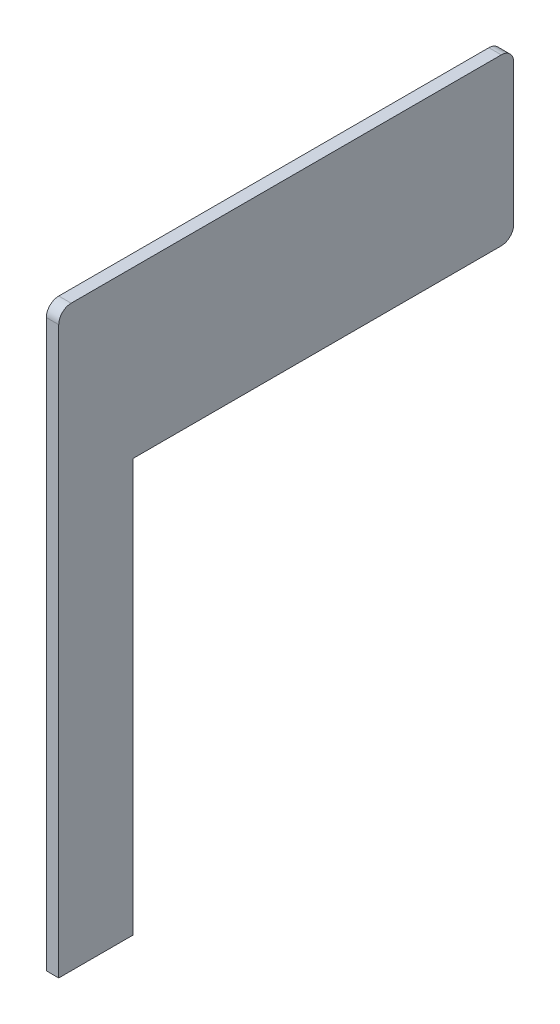
from build123d import *

# Parameters (mm, degrees)
EXTRUDE_1_DEPTH = 0.3
FILLET_1_R      = 0.3
SKETCH_4_W      = 0.3
SKETCH_4_H      = 1.8
EXTRUDE_3_DEPTH = 3


with BuildPart() as part:
    # 草图1 → 凸台-拉伸1 (new body)
    with BuildSketch(Plane(origin=(0, 0, 0), x_dir=(0, 0, -1), z_dir=(1, 0, 0))):
        Polygon((-5.5, -2), (-5.5, -1.5), (-5.5, -0.5), (-5.5, 0.5), (-5.5, 1.5), (-5.5, 2), (5.5, 2), (5.5, 1.5), (5.5, 0.5), (5.5, -0.5), (5.5, -1.5), (5.5, -2), (-3.7, -2), (-3.7, -8.98), (-5.5, -8.98), align=None)
    extrude(amount=EXTRUDE_1_DEPTH)

    # 圆角1
    fillet_1_edges = [part.edges().sort_by_distance(p)[0] for p in [
        (0.15, -2, -5.5),
        (0.15, 2, 5.5),
        (0.15, 2, -5.5),
    ]]
    fillet(fillet_1_edges, radius=FILLET_1_R)

    # 草图4 → 凸台-拉伸3 (add)
    with BuildSketch(Plane.XZ.offset(8.98)):
        with Locations((0.15, 4.6)):
            Rectangle(SKETCH_4_W, SKETCH_4_H)
    extrude(amount=EXTRUDE_3_DEPTH)


solid = part.part
